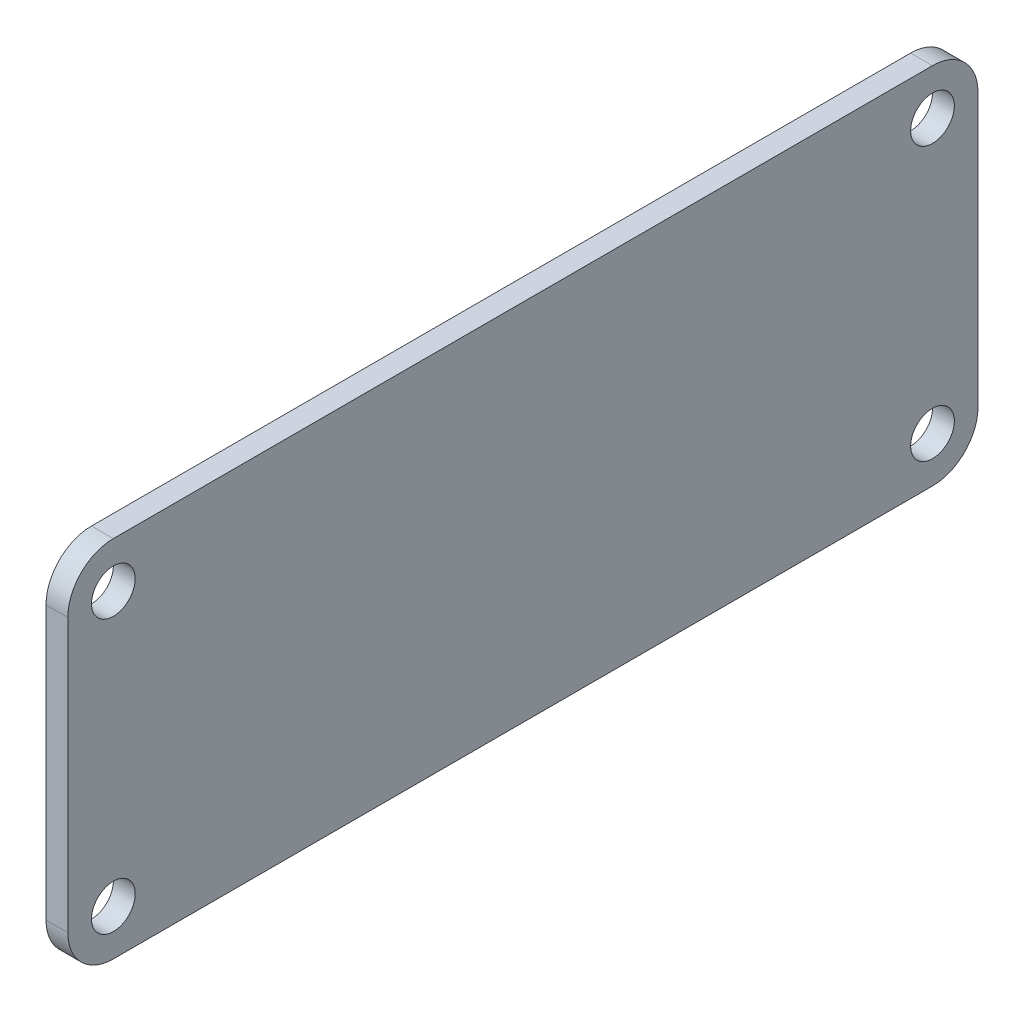
from build123d import *

# Parameters (mm, degrees)
SKETCH2_R           = 1.524
BOSS_EXTRUDE1_DEPTH = 1.524


with BuildPart() as part:
    # Sketch2 → Boss-Extrude1 (new body)
    with BuildSketch(Plane(origin=(0, 0, 0), x_dir=(0, 0, -1), z_dir=(1, 0, 0))):
        with BuildLine():
            Line((-28.575, -12.7), (28.575, -12.7))
            ThreePointArc((28.575, -12.7), (30.82006403, -11.77006403), (31.75, -9.525))
            Line((31.75, -9.525), (31.75, 9.525))
            ThreePointArc((31.75, 9.525), (30.82006403, 11.77006403), (28.575, 12.7))
            Line((28.575, 12.7), (-28.575, 12.7))
            ThreePointArc((-28.575, 12.7), (-30.82006403, 11.77006403), (-31.75, 9.525))
            Line((-31.75, 9.525), (-31.75, -9.525))
            ThreePointArc((-31.75, -9.525), (-30.82006403, -11.77006403), (-28.575, -12.7))
        make_face()
        with Locations(Location((-28.575, 9.525, 0), (0, 0, 180))):
            Circle(SKETCH2_R, mode=Mode.SUBTRACT)
        with Locations(Location((28.575, 9.525, 0), (0, 0, 180))):
            Circle(SKETCH2_R, mode=Mode.SUBTRACT)
        with Locations(Location((28.575, -9.525, 0), (0, 0, 180))):
            Circle(SKETCH2_R, mode=Mode.SUBTRACT)
        with Locations(Location((-28.575, -9.525, 0), (0, 0, 180))):
            Circle(SKETCH2_R, mode=Mode.SUBTRACT)
    extrude(amount=BOSS_EXTRUDE1_DEPTH)


solid = part.part
